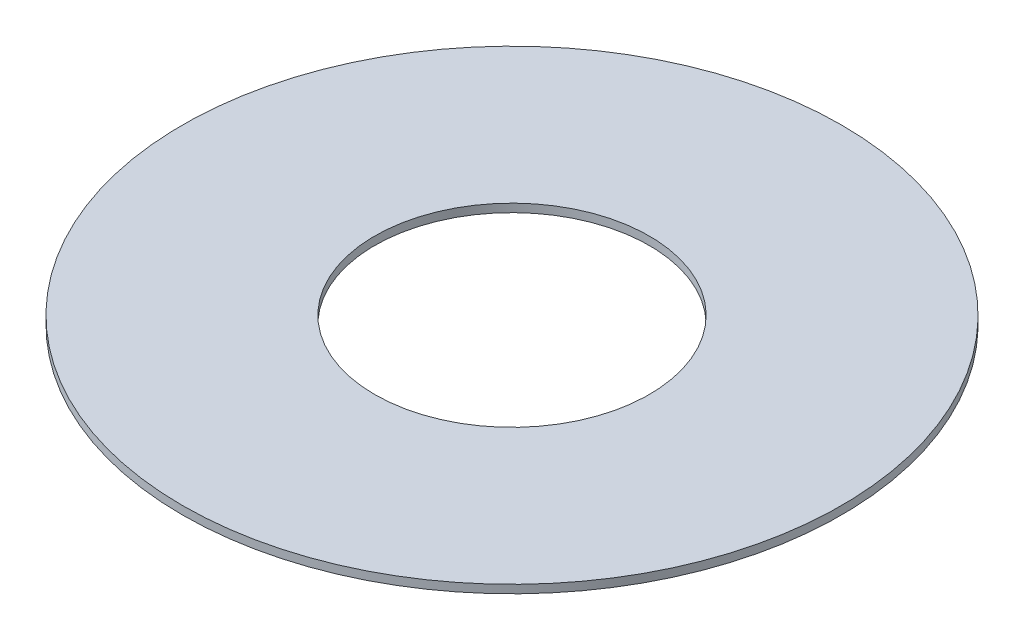
from build123d import *

# Parameters (mm, degrees)
SKETCH1_R           = 120
SKETCH1_R_2         = 50
BOSS_EXTRUDE1_DEPTH = 1.5


with BuildPart() as part:
    # Sketch1 → Boss-Extrude1 (new, symmetric)
    with BuildSketch(Plane(origin=(0, 0, 0), x_dir=(1, 0, 0), z_dir=(0, 1, 0))):
        with Locations(Location((0, 0, 0), (0, 0, 270))):
            Circle(SKETCH1_R)
        with Locations(Location((0, 0, 0), (0, 0, 270))):
            Circle(SKETCH1_R_2, mode=Mode.SUBTRACT)
    extrude(amount=BOSS_EXTRUDE1_DEPTH, both=True)


solid = part.part
